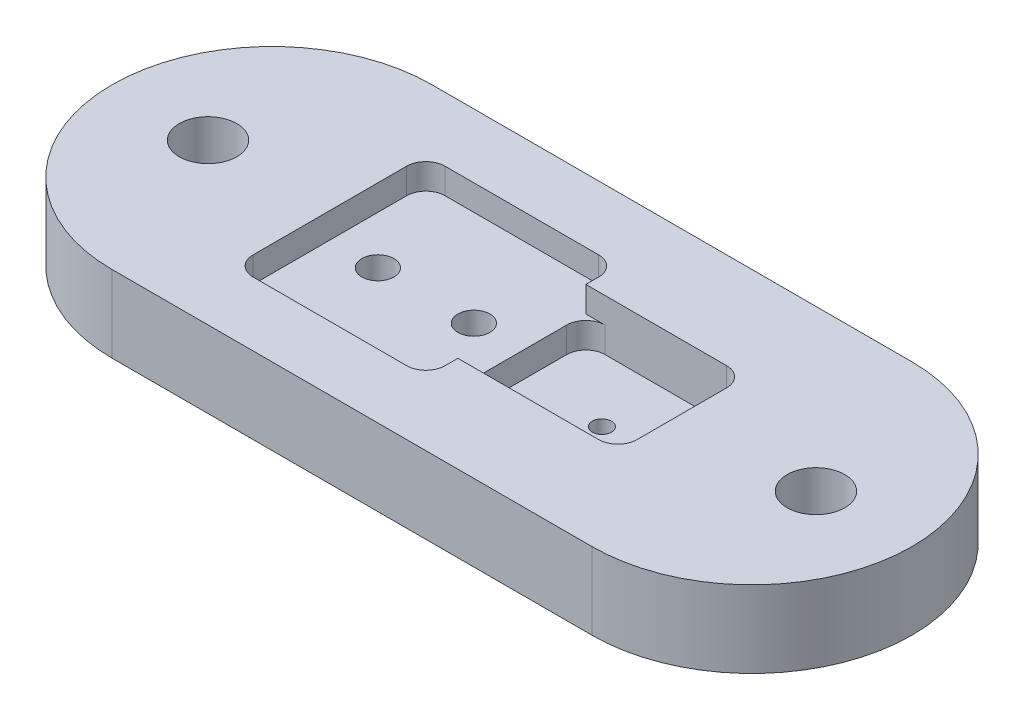
from build123d import *

# Parameters (mm, degrees)
SKETCH1_W           = 75
SKETCH1_H           = 50
BOSS_EXTRUDE1_DEPTH = 12
SKETCH2_R           = 4.5
CUT_EXTRUDE1_DEPTH  = 113.445542375
SKETCH3_W           = 30
SKETCH3_H           = 30
CUT_EXTRUDE2_DEPTH  = 4
SKETCH4_W           = 25
SKETCH4_H           = 20
CUT_EXTRUDE3_DEPTH  = 8
FILLET1_R           = 3
SKETCH5_R           = 1.5
CUT_EXTRUDE4_DEPTH  = 113.089250154
SKETCH6_R           = 2.5
CUT_EXTRUDE5_DEPTH  = 113.089250154


with BuildPart() as part:
    # Sketch1 → Boss-Extrude1 (new body)
    with BuildSketch(Plane(origin=(0, 0, 0), x_dir=(1, 0, 0), z_dir=(0, 1, 0))):
        with Locations((37.5, 25)):
            Rectangle(SKETCH1_W, SKETCH1_H)
        with BuildLine():
            Line((75, 0), (75, 50))
            ThreePointArc((75, 50), (100, 25), (75, 0))
        make_face()
        with BuildLine():
            Line((0, 0), (0, 50))
            ThreePointArc((0, 50), (-25, 25), (0, 0))
        make_face()
    extrude(amount=BOSS_EXTRUDE1_DEPTH)

    # Sketch2 → Cut-Extrude1 (cut, through all)
    with BuildSketch(Plane(origin=(0, 12, 0), x_dir=(1, 0, 0), z_dir=(0, 1, 0))):
        with Locations(Location((-10, 25, 0), (0, 0, 270))):
            Circle(SKETCH2_R)
        with Locations(Location((85, 25, 0), (0, 0, 90))):
            Circle(SKETCH2_R)
    extrude(amount=-CUT_EXTRUDE1_DEPTH, mode=Mode.SUBTRACT)

    # Sketch3 → Cut-Extrude2 (cut)
    with BuildSketch(Plane(origin=(0, 12, 0), x_dir=(1, 0, 0), z_dir=(0, 1, 0))):
        with Locations((24.041436108, 25)):
            Rectangle(SKETCH3_W, SKETCH3_H)
    extrude(amount=-CUT_EXTRUDE2_DEPTH, mode=Mode.SUBTRACT)

    # Sketch4 → Cut-Extrude3 (cut)
    with BuildSketch(Plane(origin=(0, 12, 0), x_dir=(1, 0, 0), z_dir=(0, 1, 0))):
        with Locations((51.541436108, 25)):
            Rectangle(SKETCH4_W, SKETCH4_H)
    extrude(amount=-CUT_EXTRUDE3_DEPTH, mode=Mode.SUBTRACT)

    # Fillet1
    fillet1_edges = [part.edges().sort_by_distance(p)[0] for p in [
        (9.041436108, 10, -10),
        (9.041436108, 10, -40),
        (39.041436108, 10, -40),
        (39.041436108, 10, -10),
        (64.041436108, 8, -15),
        (39.041436108, 6, -15),
        (39.041436108, 6, -35),
        (64.041436108, 8, -35),
    ]]
    fillet(fillet1_edges, radius=FILLET1_R)

    # Sketch5 → Cut-Extrude4 (cut, through all)
    with BuildSketch(Plane(origin=(0, 4, 0), x_dir=(1, 0, 0), z_dir=(0, 1, 0))):
        with Locations(Location((51.541436108, 25, 0), (0, 0, 270))):
            Circle(SKETCH5_R)
    extrude(amount=-CUT_EXTRUDE4_DEPTH, mode=Mode.SUBTRACT)

    # Sketch6 → Cut-Extrude5 (cut, through all)
    with BuildSketch(Plane(origin=(0, 8, 0), x_dir=(1, 0, 0), z_dir=(0, 1, 0))):
        with Locations(Location((16.541436108, 25, 0), (0, 0, 270))):
            Circle(SKETCH6_R)
        with Locations(Location((31.541436108, 25, 0), (0, 0, 270))):
            Circle(SKETCH6_R)
    extrude(amount=-CUT_EXTRUDE5_DEPTH, mode=Mode.SUBTRACT)


solid = part.part
